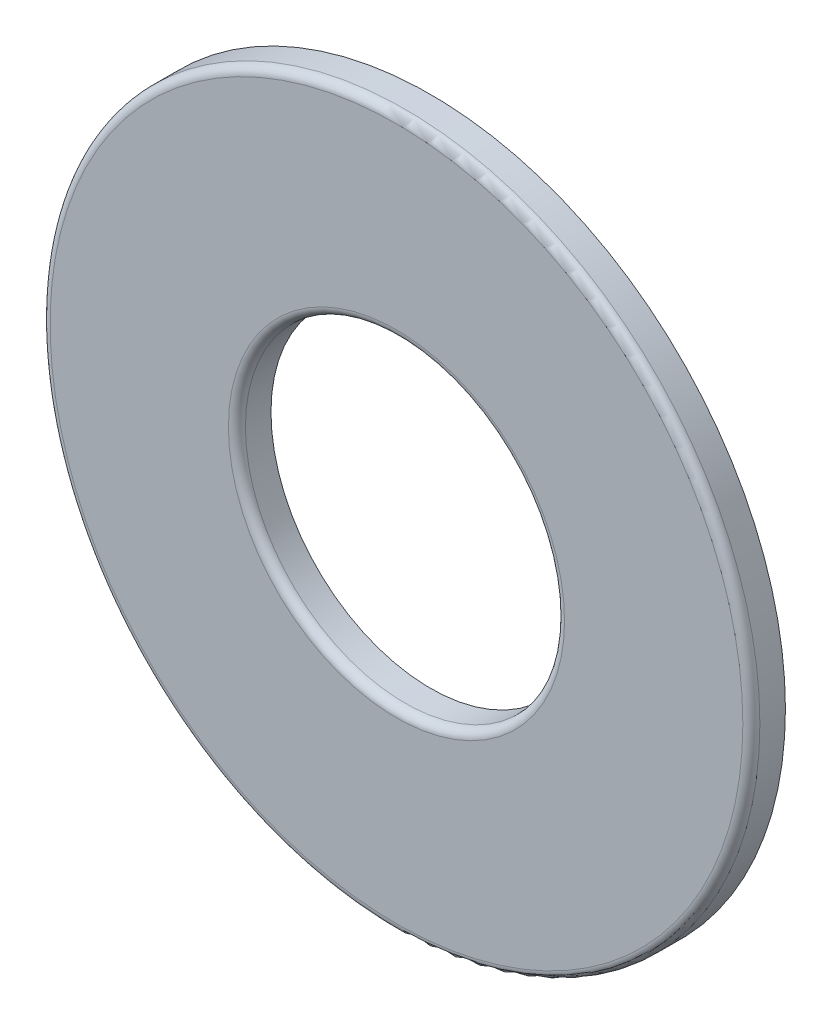
from build123d import *

# Parameters (mm, degrees)
BOSS_EXTRUDE1_DEPTH      = 0.381
BOSS_EXTRUDE1_DEPTH_BACK = 0.381
SKETCH3_R                = 7.9375
SKETCH3_R_2              = 3.5687
FILLET1_R                = 0.1905


with BuildPart() as part:
    # Sketch3 → Boss-Extrude1 (new, two sides: drawn at the far end of the back side and taken through both)
    with BuildSketch(Plane.XY.offset(-BOSS_EXTRUDE1_DEPTH_BACK)):
        with Locations(Location((0, 0, 0), (0, 0, 180))):
            Circle(SKETCH3_R)
        with Locations(Location((0, 0, 0), (0, 0, 180))):
            Circle(SKETCH3_R_2, mode=Mode.SUBTRACT)
    extrude(amount=BOSS_EXTRUDE1_DEPTH + BOSS_EXTRUDE1_DEPTH_BACK)

    # Fillet1
    fillet1_edges = [part.edges().sort_by_distance(p)[0] for p in [
        (7.9375, 0, 0.381),
        (3.5687, 0, 0.381),
    ]]
    fillet(fillet1_edges, radius=FILLET1_R)


solid = part.part
